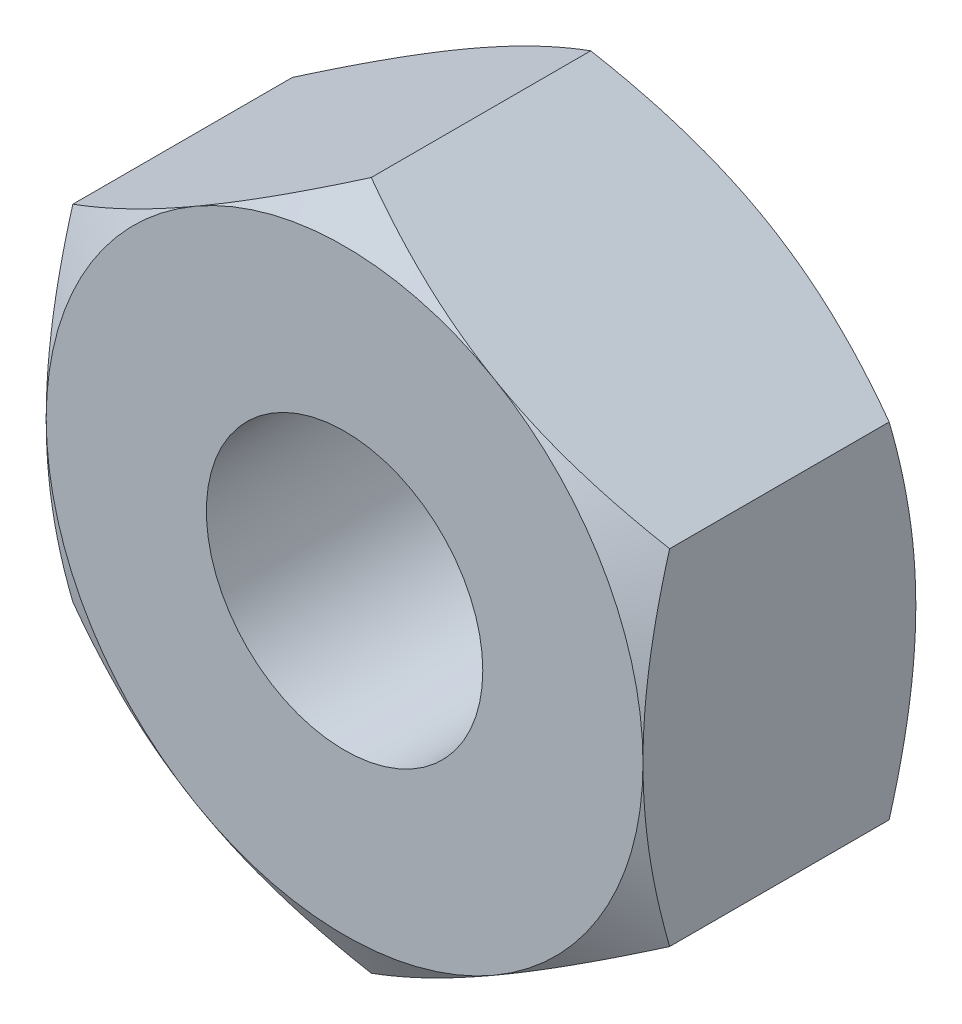
from build123d import *

# Parameters (mm, degrees)
SKETCH_1_R          = 1.621125
EXTRUDE_597_DEPTH   = 3.2
SKETCH_2_OUTSIDE_W  = 36.28
SKETCH_2_OUTSIDE_H  = 37.362
SKETCH_2_OUTSIDE_R  = 3.5
CUT_EXTRUDE_1_DEPTH = 7.23083729
CUT_EXTRUDE_1_DRAFT = -60
SKETCH_3_OUTSIDE_W  = 36.28
SKETCH_3_OUTSIDE_H  = 37.362
SKETCH_3_OUTSIDE_R  = 3.5
CUT_EXTRUDE_2_DEPTH = 7.23083729
CUT_EXTRUDE_2_DRAFT = -60


with BuildPart() as part:
    # 草图1 → Extrude 597 (new body)
    with BuildSketch(Plane.XY):
        Polygon((0, 4.041451884), (-3.5, 2.020725942), (-3.5, -2.020725942), (0, -4.041451884), (3.5, -2.020725942), (3.5, 2.020725942), align=None)
        Circle(SKETCH_1_R, mode=Mode.SUBTRACT)
    extrude(amount=EXTRUDE_597_DEPTH)


with BuildPart() as cut_extrude_1_tool:
    # 草图2 outside → 切除-拉伸1 (with draft: the straight prism first)
    with BuildSketch(Plane(origin=(0, 0, 0), x_dir=(-1, 0, 0), z_dir=(0, 0, -1))):
        Rectangle(SKETCH_2_OUTSIDE_W, SKETCH_2_OUTSIDE_H)
        Circle(SKETCH_2_OUTSIDE_R, mode=Mode.SUBTRACT)
    extrude(amount=-CUT_EXTRUDE_1_DEPTH)
    # 切除-拉伸1: the draft: its side faces are tilted about the plane it starts from
    cut_extrude_1_sides = [cut_extrude_1_tool.faces().sort_by_distance(p)[0] for p in [
        (0, -18.681, 3.615418645),
        (-18.14, 0, 3.615418645),
        (0, 18.681, 3.615418645),
        (18.14, 0, 3.615418645),
        (3.5, 0, 3.615418645),
    ]]
    draft(cut_extrude_1_sides, Plane(origin=(0, 0, 0), x_dir=(-1, 0, 0), z_dir=(0, 0, -1)), CUT_EXTRUDE_1_DRAFT)


with BuildPart() as part_1:
    add(part.part)

    # 切除-拉伸1: cut by cut_extrude_1_tool
    add(cut_extrude_1_tool.part, mode=Mode.SUBTRACT)


with BuildPart() as cut_extrude_2_tool:
    # 草图3 outside → 切除-拉伸2 (with draft: the straight prism first)
    with BuildSketch(Plane.XY.offset(3.2)):
        Rectangle(SKETCH_3_OUTSIDE_W, SKETCH_3_OUTSIDE_H)
        Circle(SKETCH_3_OUTSIDE_R, mode=Mode.SUBTRACT)
    extrude(amount=-CUT_EXTRUDE_2_DEPTH)
    # 切除-拉伸2: the draft: its side faces are tilted about the plane it starts from
    cut_extrude_2_sides = [cut_extrude_2_tool.faces().sort_by_distance(p)[0] for p in [
        (0, -18.681, -0.415418645),
        (18.14, 0, -0.415418645),
        (0, 18.681, -0.415418645),
        (-18.14, 0, -0.415418645),
        (-3.5, 0, -0.415418645),
    ]]
    draft(cut_extrude_2_sides, Plane.XY.offset(3.2), CUT_EXTRUDE_2_DRAFT)


with BuildPart() as part_2:
    add(part_1.part)

    # 切除-拉伸2: cut by cut_extrude_2_tool
    add(cut_extrude_2_tool.part, mode=Mode.SUBTRACT)


solid = part_2.part
